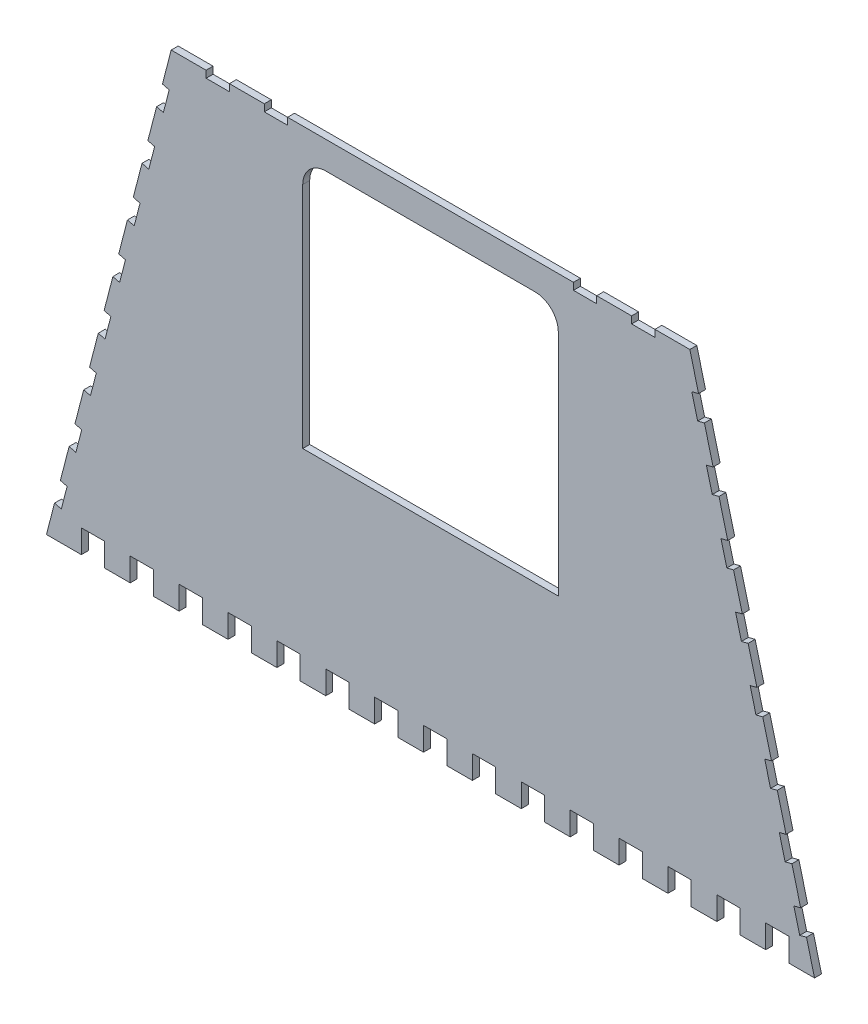
from build123d import *

# Parameters (mm, degrees)
BOSS_EXTRUDE1_DEPTH  = 3
CUT_EXTRUDE2_START   = -3
CUT_EXTRUDE2_DEPTH   = 208.044112878
LPATTERN2_COUNT      = 8
LPATTERN2_PITCH      = 25
MIRROR1_START        = -3
MIRROR1_COPY_1_DEPTH = 208.044112878
MIRROR1_COPY_2_DEPTH = 208.044112878
MIRROR1_COPY_3_DEPTH = 208.044112878
MIRROR1_COPY_4_DEPTH = 208.044112878
MIRROR1_COPY_5_DEPTH = 208.044112878
MIRROR1_COPY_6_DEPTH = 208.044112878
MIRROR1_COPY_7_DEPTH = 208.044112878
CUT_EXTRUDE3_START   = -3
CUT_EXTRUDE3_DEPTH   = 208.044112878
LPATTERN3_COUNT      = 2
LPATTERN3_PITCH      = 25
MIRROR2_START        = -3
MIRROR2_COPY_1_DEPTH = 208.044112878
SKETCH5_W            = 10
SKETCH5_H            = 10
CUT_EXTRUDE7_DEPTH   = 10
LPATTERN5_COUNT      = 15
LPATTERN5_PITCH      = 21
SKETCH9_W            = 109.8
SKETCH9_H            = 11.8
BOSS_EXTRUDE2_DEPTH  = 3
FILLET1_R            = 10


with BuildPart() as part:
    # Sketch1 → Boss-Extrude1 (new body)
    with BuildSketch(Plane.XY):
        Polygon((-111.410161514, 120), (-54.9, 120), (-54.9, 0), (54.9, 0), (54.9, 120), (111.410161514, 120), (114.865412578, 106.649935044), (117.371040649, 96.968931585), (165, -87.055236082), (-165, -87.055236082), align=None)
    extrude(amount=BOSS_EXTRUDE1_DEPTH)

    # Sketch3 → Cut-Extrude2 (cut)
    with BuildSketch(Plane.XY.offset(3).offset(CUT_EXTRUDE2_START)):
        Polygon((117.674231691, 95.797491353), (115.16860362, 105.478494812), (112.264302582, 104.72680639), (114.769930653, 95.045802932), align=None)
    cut_extrude2 = extrude(amount=CUT_EXTRUDE2_DEPTH, mode=Mode.SUBTRACT)

    # LPattern2: Cut-Extrude2 ×8
    with Locations(*[Vector(0.2505628070857313, -0.968100345886375, 0) * (i * LPATTERN2_PITCH) for i in range(1, LPATTERN2_COUNT)]):
        add(cut_extrude2, mode=Mode.SUBTRACT)

    # Mirror1: Cut-Extrude2 across plane
    add(cut_extrude2.mirror(Plane(origin=(0, 0, 0), x_dir=(0, 0, 1), z_dir=(1, 0, 0))), mode=Mode.SUBTRACT)

    # Mirror1 copy 1 sketch → Mirror1 copy 1 (cut)
    with BuildSketch(Plane(origin=(-6.264070177, -24.202508647, 3), x_dir=(-1, 0, 0), z_dir=(0, 0, 1)).offset(MIRROR1_START)):
        Polygon((117.674231691, -95.797491353), (115.16860362, -105.478494812), (112.264302582, -104.72680639), (114.769930653, -95.045802932), align=None)
    extrude(amount=MIRROR1_COPY_1_DEPTH, mode=Mode.SUBTRACT)

    # Mirror1 copy 2 sketch → Mirror1 copy 2 (cut)
    with BuildSketch(Plane(origin=(-12.528140354, -48.405017294, 3), x_dir=(-1, 0, 0), z_dir=(0, 0, 1)).offset(MIRROR1_START)):
        Polygon((117.674231691, -95.797491353), (115.16860362, -105.478494812), (112.264302582, -104.72680639), (114.769930653, -95.045802932), align=None)
    extrude(amount=MIRROR1_COPY_2_DEPTH, mode=Mode.SUBTRACT)

    # Mirror1 copy 3 sketch → Mirror1 copy 3 (cut)
    with BuildSketch(Plane(origin=(-18.792210531, -72.607525941, 3), x_dir=(-1, 0, 0), z_dir=(0, 0, 1)).offset(MIRROR1_START)):
        Polygon((117.674231691, -95.797491353), (115.16860362, -105.478494812), (112.264302582, -104.72680639), (114.769930653, -95.045802932), align=None)
    extrude(amount=MIRROR1_COPY_3_DEPTH, mode=Mode.SUBTRACT)

    # Mirror1 copy 4 sketch → Mirror1 copy 4 (cut)
    with BuildSketch(Plane(origin=(-25.056280709, -96.810034589, 3), x_dir=(-1, 0, 0), z_dir=(0, 0, 1)).offset(MIRROR1_START)):
        Polygon((117.674231691, -95.797491353), (115.16860362, -105.478494812), (112.264302582, -104.72680639), (114.769930653, -95.045802932), align=None)
    extrude(amount=MIRROR1_COPY_4_DEPTH, mode=Mode.SUBTRACT)

    # Mirror1 copy 5 sketch → Mirror1 copy 5 (cut)
    with BuildSketch(Plane(origin=(-31.320350886, -121.012543236, 3), x_dir=(-1, 0, 0), z_dir=(0, 0, 1)).offset(MIRROR1_START)):
        Polygon((117.674231691, -95.797491353), (115.16860362, -105.478494812), (112.264302582, -104.72680639), (114.769930653, -95.045802932), align=None)
    extrude(amount=MIRROR1_COPY_5_DEPTH, mode=Mode.SUBTRACT)

    # Mirror1 copy 6 sketch → Mirror1 copy 6 (cut)
    with BuildSketch(Plane(origin=(-37.584421063, -145.215051883, 3), x_dir=(-1, 0, 0), z_dir=(0, 0, 1)).offset(MIRROR1_START)):
        Polygon((117.674231691, -95.797491353), (115.16860362, -105.478494812), (112.264302582, -104.72680639), (114.769930653, -95.045802932), align=None)
    extrude(amount=MIRROR1_COPY_6_DEPTH, mode=Mode.SUBTRACT)

    # Mirror1 copy 7 sketch → Mirror1 copy 7 (cut)
    with BuildSketch(Plane(origin=(-43.84849124, -169.41756053, 3), x_dir=(-1, 0, 0), z_dir=(0, 0, 1)).offset(MIRROR1_START)):
        Polygon((117.674231691, -95.797491353), (115.16860362, -105.478494812), (112.264302582, -104.72680639), (114.769930653, -95.045802932), align=None)
    extrude(amount=MIRROR1_COPY_7_DEPTH, mode=Mode.SUBTRACT)

    # Sketch4 → Cut-Extrude3 (cut)
    with BuildSketch(Plane.XY.offset(3).offset(CUT_EXTRUDE3_START)):
        Polygon((-96.410161514, 796.954701105), (-96.410161514, 120), (-96.410161514, 117), (-86.410161514, 117), (-86.410161514, 120), (-86.410161514, 796.954701105), (-86.410161514, 2150.864103316), (-96.410161514, 2150.864103316), align=None)
    cut_extrude3 = extrude(amount=CUT_EXTRUDE3_DEPTH, mode=Mode.SUBTRACT)

    # LPattern3: Cut-Extrude3 ×2
    with Locations(*[(i * LPATTERN3_PITCH, 0, 0) for i in range(1, LPATTERN3_COUNT)]):
        add(cut_extrude3, mode=Mode.SUBTRACT)

    # Mirror2: Cut-Extrude3 across plane
    add(cut_extrude3.mirror(Plane(origin=(0, 0, 0), x_dir=(0, 0, 1), z_dir=(1, 0, 0))), mode=Mode.SUBTRACT)

    # Mirror2 copy 1 sketch → Mirror2 copy 1 (cut)
    with BuildSketch(Plane(origin=(-25, 0, 3), x_dir=(-1, 0, 0), z_dir=(0, 0, 1)).offset(MIRROR2_START)):
        Polygon((-96.410161514, -796.954701105), (-96.410161514, -120), (-96.410161514, -117), (-86.410161514, -117), (-86.410161514, -120), (-86.410161514, -796.954701105), (-86.410161514, -2150.864103316), (-96.410161514, -2150.864103316), align=None)
    extrude(amount=MIRROR2_COPY_1_DEPTH, mode=Mode.SUBTRACT)

    # Sketch5 → Cut-Extrude7 (cut)
    with BuildSketch(Plane.XY.offset(3)):
        with Locations((-145, -82.055236082)):
            Rectangle(SKETCH5_W, SKETCH5_H)
    cut_extrude7 = extrude(amount=-CUT_EXTRUDE7_DEPTH, mode=Mode.SUBTRACT)

    # LPattern5: Cut-Extrude7 ×15
    with Locations(*[(i * LPATTERN5_PITCH, 0, 0) for i in range(1, LPATTERN5_COUNT)]):
        add(cut_extrude7, mode=Mode.SUBTRACT)

    # Sketch9 → Boss-Extrude2 (add)
    with BuildSketch(Plane(origin=(0, 0, 0), x_dir=(-1, 0, 0), z_dir=(0, 0, -1))):
        with Locations((0, 114.1)):
            Rectangle(SKETCH9_W, SKETCH9_H)
    extrude(amount=-BOSS_EXTRUDE2_DEPTH)

    # Fillet1
    fillet1_edges = [part.edges().sort_by_distance(p)[0] for p in [
        (54.9, 108.2, 1.5),
        (-54.9, 108.2, 1.5),
    ]]
    fillet(fillet1_edges, radius=FILLET1_R)


solid = part.part
